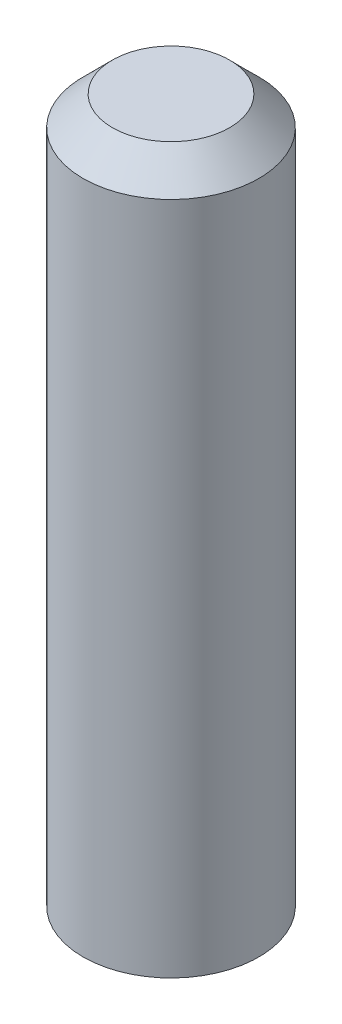
from build123d import *

# Parameters (mm, degrees)
SKETCH1_R                 = 3
BOSS_EXTRUDE1_DEPTH       = 24
CHAMFER1_SIZE             = 1
M4X0_7_TAPPED_HOLE1_D     = 3.3
M4X0_7_TAPPED_HOLE1_DEPTH = 6
M4X0_7_TAPPED_HOLE1_TIP   = 0.991420021


with BuildPart() as part:
    # Sketch1 → Boss-Extrude1 (new body)
    with BuildSketch(Plane(origin=(0, 0, 0), x_dir=(1, 0, 0), z_dir=(0, 1, 0))):
        with Locations(Location((0, 0, 0), (0, 0, 270))):
            Circle(SKETCH1_R)
    extrude(amount=BOSS_EXTRUDE1_DEPTH)

    # Chamfer1
    chamfer1_edges = [part.edges().sort_by_distance(p)[0] for p in [
        (0, 24, -3),
    ]]
    chamfer(chamfer1_edges, length=CHAMFER1_SIZE)

    # M4x0.7 Tapped Hole1
    with Locations(Plane.XZ):
        with Locations((0, 0)):
            Hole(M4X0_7_TAPPED_HOLE1_D / 2, depth=M4X0_7_TAPPED_HOLE1_DEPTH)
            with Locations((0, 0, -(M4X0_7_TAPPED_HOLE1_DEPTH + M4X0_7_TAPPED_HOLE1_TIP / 2))):  # 118° drill point
                Cone(0, M4X0_7_TAPPED_HOLE1_D / 2, M4X0_7_TAPPED_HOLE1_TIP, mode=Mode.SUBTRACT)


solid = part.part
